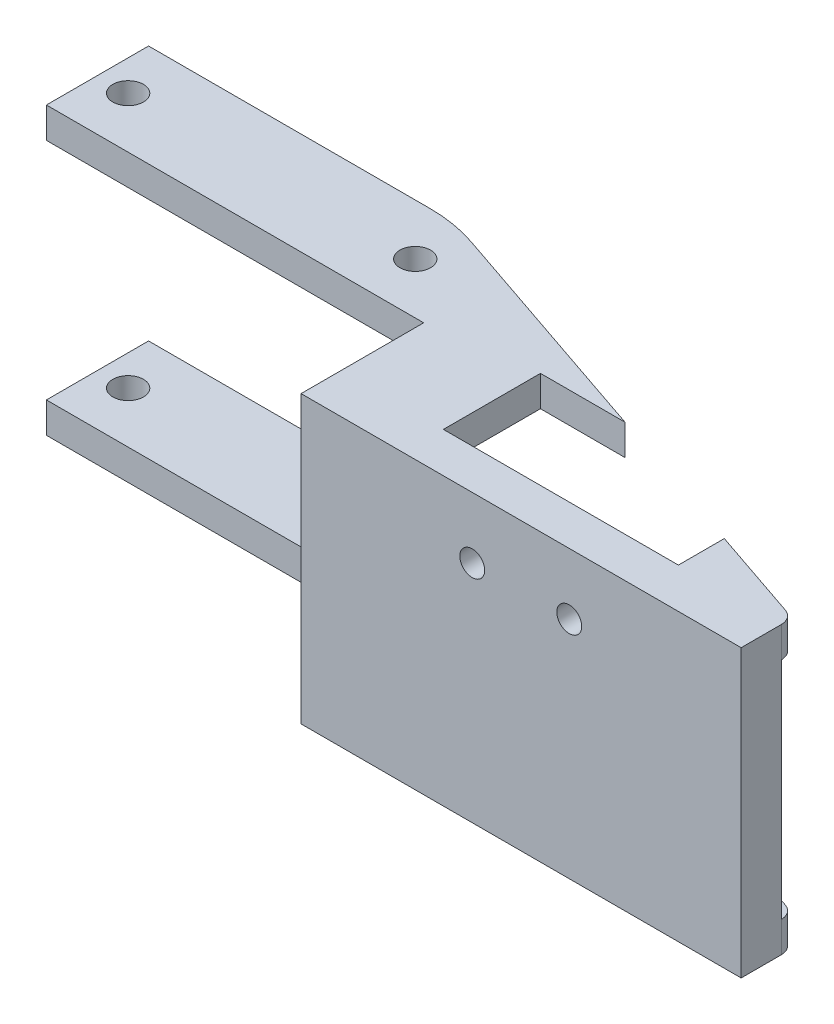
from build123d import *

# Parameters (mm, degrees)
BOSS_EXTRUDE1_DEPTH                      = 3
BOSS_EXTRUDE2_START                      = 22
BOSS_EXTRUDE2_DEPTH                      = 3
SKETCH3_W                                = 1.5
SKETCH3_H                                = 28
F_3_0MM_CLEARANCE_DOWEL_HOLE1_AT_2_COUNT = 2
F_3_0MM_CLEARANCE_DOWEL_HOLE1_AT_2_PITCH = 28.1
SKETCH5_W                                = 43.073811931
SKETCH5_H                                = 3.925670489
BOSS_EXTRUDE3_DEPTH                      = 22
SKETCH6_W                                = 23
SKETCH6_H                                = 9.5
CUT_EXTRUDE1_DEPTH                       = 10
F_2_CLEARANCE_HOLE1_D                    = 2.4384


with BuildPart() as part:
    # Sketch1 → Boss-Extrude1 (new body)
    with BuildSketch(Plane(origin=(0, 0, 0), x_dir=(1, 0, 0), z_dir=(0, 1, 0))):
        with BuildLine():
            Line((-4.577926811, 9.356292891), (42.056666031, -6.499468675))
            ThreePointArc((42.056666031, -6.499468675), (42.793295664, -7.04620955), (43.073811931, -7.919627792))
            Line((43.073811931, -7.919627792), (43.073811931, -11.845298281))
            Line((43.073811931, -11.845298281), (0, -11.845298281))
            Line((0, -11.845298281), (0, 0.154701719))
            Line((0, 0.154701719), (-36.926188069, 0.154701719))
            Line((-36.926188069, 0.154701719), (-36.926188069, 10.154701719))
            Line((-36.926188069, 10.154701719), (-9.406467809, 10.154701719))
            ThreePointArc((-9.406467809, 10.154701719), (-6.959415254, 9.953753506), (-4.577926811, 9.356292891))
        make_face()
    extrude(amount=-BOSS_EXTRUDE1_DEPTH)


with BuildPart() as body_2:
    # Sketch1<2> → Boss-Extrude2 (new body)
    with BuildSketch(Plane(origin=(0, 0, 0), x_dir=(1, 0, 0), z_dir=(0, 1, 0)).offset(BOSS_EXTRUDE2_START)):
        with BuildLine():
            Line((-4.577926811, 9.356292891), (42.056666031, -6.499468675))
            ThreePointArc((42.056666031, -6.499468675), (42.793295664, -7.04620955), (43.073811931, -7.919627792))
            Line((43.073811931, -7.919627792), (43.073811931, -11.845298281))
            Line((43.073811931, -11.845298281), (0, -11.845298281))
            Line((0, -11.845298281), (0, 0.154701719))
            Line((0, 0.154701719), (-36.926188069, 0.154701719))
            Line((-36.926188069, 0.154701719), (-36.926188069, 10.154701719))
            Line((-36.926188069, 10.154701719), (-9.406467809, 10.154701719))
            ThreePointArc((-9.406467809, 10.154701719), (-6.959415254, 9.953753506), (-4.577926811, 9.356292891))
        make_face()
    extrude(amount=BOSS_EXTRUDE2_DEPTH)


with BuildPart() as f_3_0mm_clearance_dowel_hole1_tool:
    # Sketch3 → Ø3.0mm Clearance Dowel Hole1 (revolve)
    with BuildSketch(Plane(origin=(-33.926188069, -3, -5.154701719), x_dir=(0, 0, -1), z_dir=(1, 0, 0))):
        with Locations((0.75, 14)):
            Rectangle(SKETCH3_W, SKETCH3_H)
    f_3_0mm_clearance_dowel_hole1 = revolve(axis=Axis((-33.926188069, -9.35, -5.154701719), (0, 1, 0)))


with BuildPart() as part_1:
    add(part.part)

    # Ø3.0mm Clearance Dowel Hole1: cut by f_3_0mm_clearance_dowel_hole1_tool
    add(f_3_0mm_clearance_dowel_hole1_tool.part, mode=Mode.SUBTRACT)


with BuildPart() as body_2_1:
    add(body_2.part)

    # Ø3.0mm Clearance Dowel Hole1: cut by f_3_0mm_clearance_dowel_hole1_tool
    add(f_3_0mm_clearance_dowel_hole1_tool.part, mode=Mode.SUBTRACT)


with BuildPart() as f_3_0mm_clearance_dowel_hole1_at_2_tool:
    # Ø3.0mm Clearance Dowel Hole1 at 2: Ø3.0mm Clearance Dowel Hole1 ×2
    with Locations(*[(i * F_3_0MM_CLEARANCE_DOWEL_HOLE1_AT_2_PITCH, 0, 0) for i in range(1, F_3_0MM_CLEARANCE_DOWEL_HOLE1_AT_2_COUNT)]):
        add(f_3_0mm_clearance_dowel_hole1)


with BuildPart() as part_2:
    add(part_1.part)

    # Ø3.0mm Clearance Dowel Hole1 at 2: cut by f_3_0mm_clearance_dowel_hole1_at_2_tool
    add(f_3_0mm_clearance_dowel_hole1_at_2_tool.part, mode=Mode.SUBTRACT)



with BuildPart() as body_2_2:
    add(body_2_1.part)

    # Ø3.0mm Clearance Dowel Hole1 at 2: cut by f_3_0mm_clearance_dowel_hole1_at_2_tool
    add(f_3_0mm_clearance_dowel_hole1_at_2_tool.part, mode=Mode.SUBTRACT)


with BuildPart() as part_3:
    add(part_2.part)

    add(body_2_2.part)  # Boss-Extrude3 merges body 2
    # Sketch5 → Boss-Extrude3 (add)
    with BuildSketch(Plane(origin=(0, 0, 0), x_dir=(1, 0, 0), z_dir=(0, 1, 0))):
        with Locations((21.536905966, -9.882463037)):
            Rectangle(SKETCH5_W, SKETCH5_H)
    extrude(amount=BOSS_EXTRUDE3_DEPTH)

    # Sketch6 → Cut-Extrude1 (cut)
    with BuildSketch(Plane(origin=(0, 25, 0), x_dir=(1, 0, 0), z_dir=(0, 1, 0))):
        with Locations((21.5, -3.165298281)):
            Rectangle(SKETCH6_W, SKETCH6_H)
    extrude(amount=-CUT_EXTRUDE1_DEPTH, mode=Mode.SUBTRACT)

    # #2 Clearance Hole1 (through all)
    with Locations(Plane.XY.offset(11.845298281)):
        with Locations((16.75, 19), (26.25, 19)):
            Hole(F_2_CLEARANCE_HOLE1_D / 2)


solid = part_3.part
